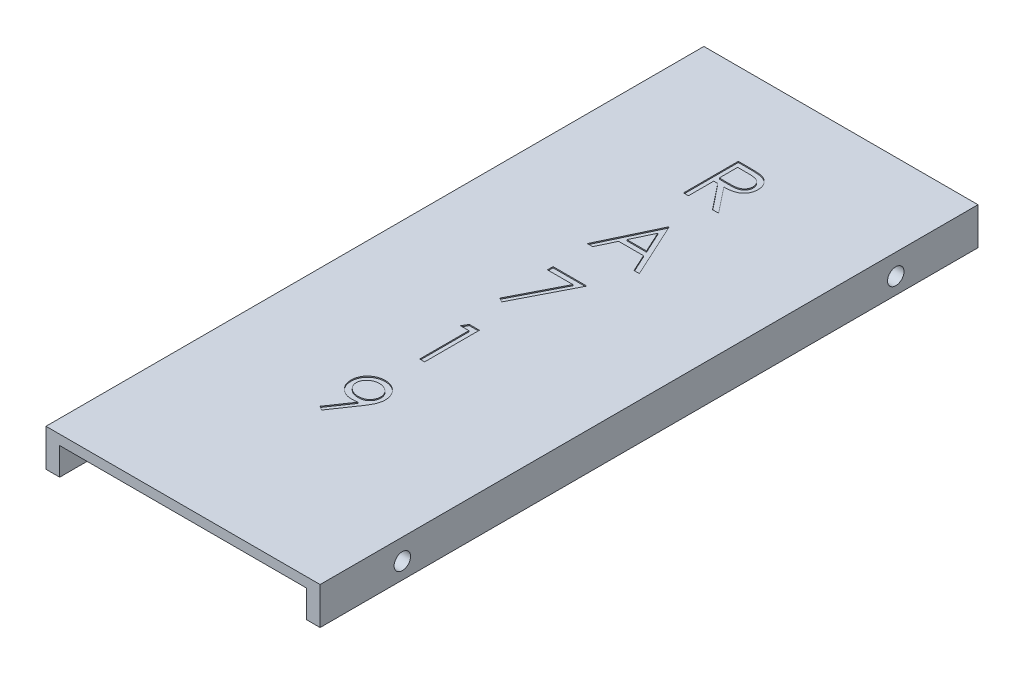
from build123d import *

# Parameters (mm, degrees)
BOSS_EXTRUDE1_DEPTH = 1200
SKETCH3_R           = 15
CUT_EXTRUDE1_DEPTH  = 1302.77724669
CUT_EXTRUDE2_DEPTH  = 2
CUT_EXTRUDE3_DEPTH  = 2


with BuildPart() as part:
    # Sketch2 → Boss-Extrude1 (new body)
    with BuildSketch(Plane.XY):
        Polygon((0, 0), (0, 68), (500, 68), (500, 0), (475, 0), (475, 50), (25, 50), (25, 0), align=None)
    extrude(amount=BOSS_EXTRUDE1_DEPTH)

    # Sketch3 → Cut-Extrude1 (cut, through all)
    with BuildSketch(Plane(origin=(500, 0, 0), x_dir=(0, 0, -1), z_dir=(1, 0, 0))):
        with Locations((-1050, 30)):
            Circle(SKETCH3_R)
        with Locations((-150, 30)):
            Circle(SKETCH3_R)
    extrude(amount=-CUT_EXTRUDE1_DEPTH, mode=Mode.SUBTRACT)

    # Sketch4 → Cut-Extrude2 (cut)
    # profile 1 of 5: a face of its own
    with BuildSketch(Plane(origin=(0, 68, 0), x_dir=(1, 0, 0), z_dir=(0, 1, 0))):
        with BuildLine():
            Line((212.820512821, -150), (232.832532051, -150))
            add(Edge.make_bspline(
                [(232.832532051, -150), (234.167992866, -150.004445314), (236.732225563, -150.012980809), (240.405747574, -150.060574035), (243.743664631, -150.196984198), (246.744231468, -150.314372298), (249.407393039, -150.528427764), (251.741315632, -150.733017682), (253.735249846, -151.000836561), (254.942274169, -151.249562931), (255.488782051, -151.362179487)],
                knots=[0, 0, 0, 0, 1.410062039, 2.707475311, 3.878576406, 4.937260626, 5.877586885, 6.699081471, 7.410979367, 8, 8, 8, 8], degree=3))
            add(Edge.make_bspline(
                [(255.488782051, -151.362179487), (256.220399884, -151.542944212), (257.668028154, -151.900617459), (259.752315756, -152.656606054), (261.738439297, -153.531452472), (263.618148563, -154.558987338), (265.382028312, -155.746838186), (267.048265763, -157.074498827), (268.624421859, -158.534704706), (270.04675415, -160.164271606), (271.387869913, -161.873886168), (272.518973527, -163.722564935), (273.494015805, -165.655751436), (274.270316291, -167.693106229), (274.895401247, -169.814871139), (275.336150944, -172.040265332), (275.60047059, -174.359150334), (275.627380749, -175.940804871), (275.641025641, -176.742788462)],
                knots=[0, 0, 0, 0, 1.027469482, 2.033020251, 3.019912614, 3.986113645, 4.951240523, 5.91722682, 6.890402269, 7.87763091, 8.8651537, 9.85103654, 10.82876324, 11.815024772, 12.821070561, 13.842952187, 14.906261191, 16, 16, 16, 16], degree=3))
            add(Edge.make_bspline(
                [(275.641025641, -176.742788462), (275.599054266, -178.075220022), (275.517157244, -180.675139104), (274.753582853, -184.448307145), (273.502825147, -187.968001849), (271.779302603, -191.229791503), (269.58446044, -194.170095657), (266.946609266, -196.752680094), (263.864277509, -198.913820453), (260.994868482, -200.412472016), (258.460177062, -201.372269406), (256.373510983, -202.047593945), (254.097311626, -202.569364381), (251.65338778, -203.036796717), (249.031569051, -203.389702272), (246.238139354, -203.6481764), (243.271106451, -203.809720648), (241.232847326, -203.833777931), (240.184294872, -203.846153846)],
                knots=[0, 0, 0, 0, 1.260483769, 2.459530307, 3.627416485, 4.787058657, 5.939039949, 7.08810263, 8.267026773, 9.491475466, 10.141966685, 10.831826277, 11.566392101, 12.351337768, 13.187381173, 14.07005841, 15.007169909, 16, 16, 16, 16], degree=3))
            Line((240.184294872, -203.846153846), (276.923076923, -250))
            Line((276.923076923, -250), (265.825320513, -250))
            Line((265.825320513, -250), (229.086538462, -203.846153846))
            Line((229.086538462, -203.846153846), (221.794871795, -203.846153846))
            Line((221.794871795, -203.846153846), (221.794871795, -250))
            Line((221.794871795, -250), (212.820512821, -250))
            Line((212.820512821, -250), (212.820512821, -150))
        make_face()
        with BuildLine():
            Line((221.794871795, -160.256410256), (221.794871795, -193.58974359))
            Line((221.794871795, -193.58974359), (240.104166667, -193.729967949))
            add(Edge.make_bspline(
                [(240.104166667, -193.729967949), (240.959024922, -193.730346139), (242.615983696, -193.731079179), (245.013145548, -193.616971286), (247.245148739, -193.487162194), (249.303455944, -193.288609464), (251.188986668, -193.0327217), (252.900798474, -192.712636436), (254.441685671, -192.339720361), (256.238786769, -191.762531052), (258.245544808, -190.848073387), (260.426443661, -189.517630567), (262.283653311, -187.844227163), (263.852735091, -185.930699847), (265.113575991, -183.826807023), (266.002491829, -181.557767903), (266.566561609, -179.180865103), (266.633091479, -177.547204879), (266.666666667, -176.72275641)],
                knots=[0, 0, 0, 0, 1.146690395, 2.22261258, 3.21895312, 4.145990853, 4.996080663, 5.770904154, 6.481378293, 7.121626537, 8.300444488, 9.431385265, 10.535395872, 11.636531494, 12.74115979, 13.810798291, 14.895190096, 16, 16, 16, 16], degree=3))
            add(Edge.make_bspline(
                [(266.666666667, -176.72275641), (266.63232035, -175.918568589), (266.564258483, -174.32496177), (266.008579382, -171.991935762), (265.068882772, -169.790022901), (263.802533117, -167.728180473), (262.259700118, -165.85658802), (260.450619755, -164.255240789), (258.424757036, -162.933827513), (256.531294226, -162.089416641), (254.838888155, -161.571706548), (253.369469297, -161.207387582), (251.709141362, -160.91468847), (249.849842545, -160.680172445), (247.799510236, -160.478602609), (245.547777348, -160.342837505), (243.109583626, -160.262441388), (241.419671307, -160.25846742), (240.544871795, -160.256410256)],
                knots=[0, 0, 0, 0, 1.101028733, 2.181837193, 3.264309656, 4.369019818, 5.486613113, 6.575447106, 7.666700264, 8.788928104, 9.402425223, 10.0903467, 10.862060571, 11.710948788, 12.657782767, 13.684531032, 14.801375019, 16, 16, 16, 16], degree=3))
            Line((240.544871795, -160.256410256), (221.794871795, -160.256410256))
        make_face(mode=Mode.SUBTRACT)
    # profile 2 of 5: a face of its own
    with BuildSketch(Plane(origin=(0, 68, 0), x_dir=(1, 0, 0), z_dir=(0, 1, 0))):
        Polygon((253.846153846, -317.666666667), (300, -417.666666667), (290.244391026, -417.666666667), (275.460737179, -385.615384615), (230.128205128, -385.615384615), (214.923878205, -417.666666667), (205.128205128, -417.666666667), (252.564102564, -317.666666667), align=None)
        Polygon((253.104967949, -337.157852564), (234.99599359, -375.358974359), (270.733173077, -375.358974359), align=None, mode=Mode.SUBTRACT)
    # profile 3 of 5: a face of its own
    with BuildSketch(Plane(origin=(0, 68, 0), x_dir=(1, 0, 0), z_dir=(0, 1, 0))):
        Polygon((210.256410256, -485.333333333), (271.794871795, -485.333333333), (219.230769231, -587.897435897), (211.478365385, -583.630608974), (256.610576923, -495.58974359), (210.256410256, -495.58974359), align=None)
    # profile 4 of 5: a face of its own
    with BuildSketch(Plane(origin=(0, 68, 0), x_dir=(1, 0, 0), z_dir=(0, 1, 0))):
        Polygon((225.100160256, -653), (243.58974359, -653), (243.58974359, -753), (234.615384615, -753), (234.615384615, -663.256410256), (219.230769231, -663.256410256), align=None)
    # profile 5 of 5: a face of its own
    with BuildSketch(Plane(origin=(0, 68, 0), x_dir=(1, 0, 0), z_dir=(0, 1, 0))):
        with BuildLine():
            Line((225.641025641, -923.230769231), (218.469551282, -918.242788462))
            Line((218.469551282, -918.242788462), (246.274038462, -877.59775641))
            add(Edge.make_bspline(
                [(246.274038462, -877.59775641), (244.500017444, -877.814701077), (241.006871155, -878.24187722), (237.488668238, -878.320353069), (235.757211538, -878.358974359)],
                knots=[0, 0, 0, 0, 1.015715272, 2, 2, 2, 2], degree=3))
            add(Edge.make_bspline(
                [(235.757211538, -878.358974359), (234.707438744, -878.33208646), (232.646826549, -878.279307866), (229.617350762, -877.860970486), (226.706334746, -877.216681121), (223.921496005, -876.255288119), (221.252367295, -875.060482147), (218.704775484, -873.578853186), (216.282150041, -871.835816284), (214.010509757, -869.840587954), (211.944460074, -867.649786455), (210.103794424, -865.3310538), (208.574047796, -862.857454638), (207.303288214, -860.279448365), (206.339560969, -857.559981198), (205.637774181, -854.729998337), (205.205706913, -851.769665709), (205.154304183, -849.754661973), (205.128205128, -848.731570513)],
                knots=[0, 0, 0, 0, 1.060718605, 2.082097864, 3.085795603, 4.069760067, 5.054557537, 6.03741023, 7.043284206, 8.066802108, 9.088538119, 10.083643548, 11.053783639, 12.022749082, 12.983451788, 13.964007469, 14.966251758, 16, 16, 16, 16], degree=3))
            add(Edge.make_bspline(
                [(205.128205128, -848.731570513), (205.177760408, -847.332466149), (205.275027369, -844.586308105), (206.057842148, -840.573914704), (207.34528041, -836.780013458), (209.140376889, -833.214579346), (211.40136893, -829.928901083), (214.118757221, -826.968655108), (217.276013343, -824.375944998), (220.80121389, -822.147257072), (224.611300197, -820.354828578), (228.601833285, -819.033705707), (232.742236716, -818.256598626), (235.547027291, -818.154145451), (236.959134615, -818.102564103)],
                knots=[0, 0, 0, 0, 1.022988612, 2.007919123, 2.978103895, 3.94594894, 4.918897164, 5.887013414, 6.875921846, 7.89917871, 8.930658928, 9.948724884, 10.967259574, 12, 12, 12, 12], degree=3))
            add(Edge.make_bspline(
                [(236.959134615, -818.102564103), (238.344518032, -818.154854476), (241.081905084, -818.258175324), (245.107305272, -819.014860155), (248.962762899, -820.290193664), (252.626905376, -822.052609771), (256.019460011, -824.261778562), (259.070197474, -826.894193526), (261.709498591, -829.951494304), (263.933038041, -833.359736877), (265.717896335, -837.021650625), (267.005675849, -840.844048411), (267.798408391, -844.799440448), (267.898303451, -847.479282564), (267.948717949, -848.831730769)],
                knots=[0, 0, 0, 0, 1.026385292, 2.028040595, 3.023318987, 4.028184125, 5.03290303, 6.015178782, 7.004435299, 8.016004309, 9.023023918, 10.015172535, 10.998308025, 12, 12, 12, 12], degree=3))
            add(Edge.make_bspline(
                [(267.948717949, -848.831730769), (267.915049123, -849.881552688), (267.84676033, -852.01085385), (267.368580127, -855.246006502), (266.556574835, -858.544613059), (265.635097729, -861.336658651), (264.745607224, -863.642614359), (263.908432033, -865.464088073), (262.979513361, -867.381267025), (261.896120061, -869.374048108), (260.731483012, -871.467834821), (259.415503682, -873.6416267), (257.978201631, -875.898340791), (256.954495353, -877.419686163), (256.430288462, -878.198717949)],
                knots=[0, 0, 0, 0, 1.179839688, 2.393009684, 3.667231171, 4.993948276, 5.694988576, 6.444077775, 7.246288328, 8.089075292, 8.993003841, 9.939041771, 10.944649915, 12, 12, 12, 12], degree=3))
            Line((256.430288462, -878.198717949), (225.641025641, -923.230769231))
        make_face()
        with BuildLine():
            add(Edge.make_bspline(
                [(237.419871795, -868.102564103), (238.215129341, -868.080838852), (239.763225429, -868.038547175), (242.031148258, -867.781140264), (244.171839784, -867.324740661), (246.191018336, -866.669891745), (248.108929819, -865.879701205), (249.895110625, -864.87364446), (251.551055631, -863.673169176), (253.087853547, -862.324311586), (254.452539254, -860.825723484), (255.668054417, -859.257234722), (256.701213486, -857.611960152), (257.517307117, -855.869295515), (258.188294987, -854.071660988), (258.65166676, -852.190107981), (258.908361996, -850.234439391), (258.952121279, -848.905906305), (258.974358974, -848.230769231)],
                knots=[0, 0, 0, 0, 1.163407946, 2.26475976, 3.333800367, 4.359385343, 5.366239384, 6.363380779, 7.350133999, 8.353570782, 9.349036268, 10.310270964, 11.253520213, 12.184142, 13.120487599, 14.056272588, 15.012232024, 16, 16, 16, 16], degree=3))
            add(Edge.make_bspline(
                [(258.974358974, -848.230769231), (258.955225569, -847.555350224), (258.917520848, -846.224354225), (258.61502657, -844.265790228), (258.082877338, -842.388839919), (257.36886349, -840.583227635), (256.428285266, -838.863788439), (255.299614245, -837.208934959), (253.958687108, -835.62915988), (252.415756646, -834.161617492), (250.751912275, -832.808820371), (248.978755125, -831.614932486), (247.110900382, -830.614326875), (245.159743529, -829.788642022), (243.121219274, -829.144305574), (240.996533896, -828.680952298), (238.774950882, -828.424616453), (237.266914134, -828.381133753), (236.498397436, -828.358974359)],
                knots=[0, 0, 0, 0, 0.972161553, 1.915763587, 2.844109794, 3.775983486, 4.705125789, 5.659731448, 6.655561913, 7.682237399, 8.721216875, 9.739758359, 10.754845918, 11.767244016, 12.7857855, 13.828538656, 14.893392813, 16, 16, 16, 16], degree=3))
            add(Edge.make_bspline(
                [(236.498397436, -828.358974359), (235.736564483, -828.38116955), (234.241854503, -828.424716332), (232.040021376, -828.680465051), (229.929702295, -829.147421743), (227.897084573, -829.788343565), (225.945985696, -830.614388469), (224.078219049, -831.614984916), (222.304647143, -832.808545551), (220.642397977, -834.162681907), (219.096743061, -835.622328939), (217.778870804, -837.21585548), (216.647616745, -838.862927607), (215.70833095, -840.583456414), (214.993973313, -842.388778859), (214.461916124, -844.265806767), (214.159397117, -846.224349915), (214.121695787, -847.555348774), (214.102564103, -848.230769231)],
                knots=[0, 0, 0, 0, 1.099389452, 2.15699305, 3.192601482, 4.213358962, 5.227959689, 6.245255729, 7.266013209, 8.307253147, 9.336162325, 10.327954924, 11.284637477, 12.215801273, 13.149702402, 14.080068371, 15.025723358, 16, 16, 16, 16], degree=3))
            add(Edge.make_bspline(
                [(214.102564103, -848.230769231), (214.119876277, -848.906432052), (214.154019054, -850.2389628), (214.483384475, -852.196859739), (215.03419247, -854.073665282), (215.771889344, -855.887628339), (216.743363348, -857.62111), (217.93547329, -859.265891769), (219.332774605, -860.840618917), (220.916588539, -862.32082497), (222.649964566, -863.679458557), (224.501300169, -864.8660409), (226.43872408, -865.868110741), (228.469056388, -866.672150281), (230.57725067, -867.318197809), (232.782254424, -867.780299104), (235.076775495, -868.036078154), (236.631346404, -868.080189496), (237.419871795, -868.102564103)],
                knots=[0, 0, 0, 0, 0.952633368, 1.87876736, 2.791047057, 3.707742249, 4.635551637, 5.587206343, 6.568248508, 7.601284464, 8.641511608, 9.671105535, 10.699146789, 11.713763218, 12.747829548, 13.806491675, 14.887386225, 16, 16, 16, 16], degree=3))
        make_face(mode=Mode.SUBTRACT)
    extrude(amount=-CUT_EXTRUDE2_DEPTH, mode=Mode.SUBTRACT)

    # Sketch5 → Cut-Extrude3 (cut)
    # profile 1 of 5: a face of its own
    with BuildSketch(Plane.XZ.offset(-50)):
        with BuildLine():
            Line((212.820512821, 1050), (232.832532051, 1050))
            add(Edge.make_bspline(
                [(232.832532051, 1050), (234.167992866, 1049.995554686), (236.732225563, 1049.987019191), (240.405747574, 1049.939425965), (243.743664631, 1049.803015802), (246.744231468, 1049.685627702), (249.407393039, 1049.471572236), (251.741315632, 1049.266982318), (253.735249846, 1048.999163439), (254.942274169, 1048.750437069), (255.488782051, 1048.637820513)],
                knots=[0, 0, 0, 0, 1.410062039, 2.707475311, 3.878576406, 4.937260626, 5.877586885, 6.699081471, 7.410979367, 8, 8, 8, 8], degree=3))
            add(Edge.make_bspline(
                [(255.488782051, 1048.637820513), (256.220399884, 1048.457055788), (257.668028154, 1048.099382541), (259.752315756, 1047.343393946), (261.738439297, 1046.468547528), (263.618148563, 1045.441012662), (265.382028312, 1044.253161814), (267.048265763, 1042.925501173), (268.624421859, 1041.465295294), (270.04675415, 1039.835728394), (271.387869913, 1038.126113832), (272.518973527, 1036.277435065), (273.494015805, 1034.344248564), (274.270316291, 1032.306893771), (274.895401247, 1030.185128861), (275.336150944, 1027.959734668), (275.60047059, 1025.640849666), (275.627380749, 1024.059195129), (275.641025641, 1023.257211538)],
                knots=[0, 0, 0, 0, 1.027469482, 2.033020251, 3.019912614, 3.986113645, 4.951240523, 5.91722682, 6.890402269, 7.87763091, 8.8651537, 9.85103654, 10.82876324, 11.815024772, 12.821070561, 13.842952187, 14.906261191, 16, 16, 16, 16], degree=3))
            add(Edge.make_bspline(
                [(275.641025641, 1023.257211538), (275.599054266, 1021.924779978), (275.517157244, 1019.324860896), (274.753582853, 1015.551692855), (273.502825147, 1012.031998151), (271.779302603, 1008.770208497), (269.58446044, 1005.829904343), (266.946609266, 1003.247319906), (263.864277509, 1001.086179547), (260.994868482, 999.587527984), (258.460177062, 998.627730594), (256.373510983, 997.952406055), (254.097311626, 997.430635619), (251.65338778, 996.963203283), (249.031569051, 996.610297728), (246.238139354, 996.3518236), (243.271106451, 996.190279352), (241.232847326, 996.166222069), (240.184294872, 996.153846154)],
                knots=[0, 0, 0, 0, 1.260483769, 2.459530307, 3.627416485, 4.787058657, 5.939039949, 7.08810263, 8.267026773, 9.491475466, 10.141966685, 10.831826277, 11.566392101, 12.351337768, 13.187381173, 14.07005841, 15.007169909, 16, 16, 16, 16], degree=3))
            Line((240.184294872, 996.153846154), (276.923076923, 950))
            Line((276.923076923, 950), (265.825320513, 950))
            Line((265.825320513, 950), (229.086538462, 996.153846154))
            Line((229.086538462, 996.153846154), (221.794871795, 996.153846154))
            Line((221.794871795, 996.153846154), (221.794871795, 950))
            Line((221.794871795, 950), (212.820512821, 950))
            Line((212.820512821, 950), (212.820512821, 1050))
        make_face()
        with BuildLine():
            Line((221.794871795, 1039.743589744), (221.794871795, 1006.41025641))
            Line((221.794871795, 1006.41025641), (240.104166667, 1006.270032051))
            add(Edge.make_bspline(
                [(240.104166667, 1006.270032051), (240.959024922, 1006.269653861), (242.615983696, 1006.268920821), (245.013145548, 1006.383028714), (247.245148739, 1006.512837806), (249.303455944, 1006.711390536), (251.188986668, 1006.9672783), (252.900798474, 1007.287363564), (254.441685671, 1007.660279639), (256.238786769, 1008.237468948), (258.245544808, 1009.151926613), (260.426443661, 1010.482369433), (262.283653311, 1012.155772837), (263.852735091, 1014.069300153), (265.113575991, 1016.173192977), (266.002491829, 1018.442232097), (266.566561609, 1020.819134897), (266.633091479, 1022.452795121), (266.666666667, 1023.27724359)],
                knots=[0, 0, 0, 0, 1.146690395, 2.22261258, 3.21895312, 4.145990853, 4.996080663, 5.770904154, 6.481378293, 7.121626537, 8.300444488, 9.431385265, 10.535395872, 11.636531494, 12.74115979, 13.810798291, 14.895190096, 16, 16, 16, 16], degree=3))
            add(Edge.make_bspline(
                [(266.666666667, 1023.27724359), (266.63232035, 1024.081431411), (266.564258483, 1025.67503823), (266.008579382, 1028.008064238), (265.068882772, 1030.209977099), (263.802533117, 1032.271819527), (262.259700118, 1034.14341198), (260.450619755, 1035.744759211), (258.424757036, 1037.066172487), (256.531294226, 1037.910583359), (254.838888155, 1038.428293452), (253.369469297, 1038.792612418), (251.709141362, 1039.08531153), (249.849842545, 1039.319827555), (247.799510236, 1039.521397391), (245.547777348, 1039.657162495), (243.109583626, 1039.737558612), (241.419671307, 1039.74153258), (240.544871795, 1039.743589744)],
                knots=[0, 0, 0, 0, 1.101028733, 2.181837193, 3.264309656, 4.369019818, 5.486613113, 6.575447106, 7.666700264, 8.788928104, 9.402425223, 10.0903467, 10.862060571, 11.710948788, 12.657782767, 13.684531032, 14.801375019, 16, 16, 16, 16], degree=3))
            Line((240.544871795, 1039.743589744), (221.794871795, 1039.743589744))
        make_face(mode=Mode.SUBTRACT)
    # profile 2 of 5: a face of its own
    with BuildSketch(Plane.XZ.offset(-50)):
        Polygon((253.846153846, 882.333333333), (300, 782.333333333), (290.244391026, 782.333333333), (275.460737179, 814.384615385), (230.128205128, 814.384615385), (214.923878205, 782.333333333), (205.128205128, 782.333333333), (252.564102564, 882.333333333), align=None)
        Polygon((253.104967949, 862.842147436), (234.99599359, 824.641025641), (270.733173077, 824.641025641), align=None, mode=Mode.SUBTRACT)
    # profile 3 of 5: a face of its own
    with BuildSketch(Plane.XZ.offset(-50)):
        Polygon((210.256410256, 714.666666667), (271.794871795, 714.666666667), (219.230769231, 612.102564103), (211.478365385, 616.369391026), (256.610576923, 704.41025641), (210.256410256, 704.41025641), align=None)
    # profile 4 of 5: a face of its own
    with BuildSketch(Plane.XZ.offset(-50)):
        Polygon((225.100160256, 547), (243.58974359, 547), (243.58974359, 447), (234.615384615, 447), (234.615384615, 536.743589744), (219.230769231, 536.743589744), align=None)
    # profile 5 of 5: a face of its own
    with BuildSketch(Plane.XZ.offset(-50)):
        with BuildLine():
            Line((225.641025641, 276.769230769), (218.469551282, 281.757211538))
            Line((218.469551282, 281.757211538), (246.274038462, 322.40224359))
            add(Edge.make_bspline(
                [(246.274038462, 322.40224359), (244.500017444, 322.185298923), (241.006871155, 321.75812278), (237.488668238, 321.679646931), (235.757211538, 321.641025641)],
                knots=[0, 0, 0, 0, 1.015715272, 2, 2, 2, 2], degree=3))
            add(Edge.make_bspline(
                [(235.757211538, 321.641025641), (234.707438744, 321.66791354), (232.646826549, 321.720692134), (229.617350762, 322.139029514), (226.706334746, 322.783318879), (223.921496005, 323.744711881), (221.252367295, 324.939517853), (218.704775484, 326.421146814), (216.282150041, 328.164183716), (214.010509757, 330.159412046), (211.944460074, 332.350213545), (210.103794424, 334.6689462), (208.574047796, 337.142545362), (207.303288214, 339.720551635), (206.339560969, 342.440018802), (205.637774181, 345.270001663), (205.205706913, 348.230334291), (205.154304183, 350.245338027), (205.128205128, 351.268429487)],
                knots=[0, 0, 0, 0, 1.060718605, 2.082097864, 3.085795603, 4.069760067, 5.054557537, 6.03741023, 7.043284206, 8.066802108, 9.088538119, 10.083643548, 11.053783639, 12.022749082, 12.983451788, 13.964007469, 14.966251758, 16, 16, 16, 16], degree=3))
            add(Edge.make_bspline(
                [(205.128205128, 351.268429487), (205.177760408, 352.667533851), (205.275027369, 355.413691895), (206.057842148, 359.426085296), (207.34528041, 363.219986542), (209.140376889, 366.785420654), (211.40136893, 370.071098917), (214.118757221, 373.031344892), (217.276013343, 375.624055002), (220.80121389, 377.852742928), (224.611300197, 379.645171422), (228.601833285, 380.966294293), (232.742236716, 381.743401374), (235.547027291, 381.845854549), (236.959134615, 381.897435897)],
                knots=[0, 0, 0, 0, 1.022988612, 2.007919123, 2.978103895, 3.94594894, 4.918897164, 5.887013414, 6.875921846, 7.89917871, 8.930658928, 9.948724884, 10.967259574, 12, 12, 12, 12], degree=3))
            add(Edge.make_bspline(
                [(236.959134615, 381.897435897), (238.344518032, 381.845145524), (241.081905084, 381.741824676), (245.107305272, 380.985139845), (248.962762899, 379.709806336), (252.626905376, 377.947390229), (256.019460011, 375.738221438), (259.070197474, 373.105806474), (261.709498591, 370.048505696), (263.933038041, 366.640263123), (265.717896335, 362.978349375), (267.005675849, 359.155951589), (267.798408391, 355.200559552), (267.898303451, 352.520717436), (267.948717949, 351.168269231)],
                knots=[0, 0, 0, 0, 1.026385292, 2.028040595, 3.023318987, 4.028184125, 5.03290303, 6.015178782, 7.004435299, 8.016004309, 9.023023918, 10.015172535, 10.998308025, 12, 12, 12, 12], degree=3))
            add(Edge.make_bspline(
                [(267.948717949, 351.168269231), (267.915049123, 350.118447312), (267.84676033, 347.98914615), (267.368580127, 344.753993498), (266.556574835, 341.455386941), (265.635097729, 338.663341349), (264.745607224, 336.357385641), (263.908432033, 334.535911927), (262.979513361, 332.618732975), (261.896120061, 330.625951892), (260.731483012, 328.532165179), (259.415503682, 326.3583733), (257.978201631, 324.101659209), (256.954495353, 322.580313837), (256.430288462, 321.801282051)],
                knots=[0, 0, 0, 0, 1.179839688, 2.393009684, 3.667231171, 4.993948276, 5.694988576, 6.444077775, 7.246288328, 8.089075292, 8.993003841, 9.939041771, 10.944649915, 12, 12, 12, 12], degree=3))
            Line((256.430288462, 321.801282051), (225.641025641, 276.769230769))
        make_face()
        with BuildLine():
            add(Edge.make_bspline(
                [(237.419871795, 331.897435897), (238.215129341, 331.919161148), (239.763225429, 331.961452825), (242.031148258, 332.218859736), (244.171839784, 332.675259339), (246.191018336, 333.330108255), (248.108929819, 334.120298795), (249.895110625, 335.12635554), (251.551055631, 336.326830824), (253.087853547, 337.675688414), (254.452539254, 339.174276516), (255.668054417, 340.742765278), (256.701213486, 342.388039848), (257.517307117, 344.130704485), (258.188294987, 345.928339012), (258.65166676, 347.809892019), (258.908361996, 349.765560609), (258.952121279, 351.094093695), (258.974358974, 351.769230769)],
                knots=[0, 0, 0, 0, 1.163407946, 2.26475976, 3.333800367, 4.359385343, 5.366239384, 6.363380779, 7.350133999, 8.353570782, 9.349036268, 10.310270964, 11.253520213, 12.184142, 13.120487599, 14.056272588, 15.012232024, 16, 16, 16, 16], degree=3))
            add(Edge.make_bspline(
                [(258.974358974, 351.769230769), (258.955225569, 352.444649776), (258.917520848, 353.775645775), (258.61502657, 355.734209772), (258.082877338, 357.611160081), (257.36886349, 359.416772365), (256.428285266, 361.136211561), (255.299614245, 362.791065041), (253.958687108, 364.37084012), (252.415756646, 365.838382508), (250.751912275, 367.191179629), (248.978755125, 368.385067514), (247.110900382, 369.385673125), (245.159743529, 370.211357978), (243.121219274, 370.855694426), (240.996533896, 371.319047702), (238.774950882, 371.575383547), (237.266914134, 371.618866247), (236.498397436, 371.641025641)],
                knots=[0, 0, 0, 0, 0.972161553, 1.915763587, 2.844109794, 3.775983486, 4.705125789, 5.659731448, 6.655561913, 7.682237399, 8.721216875, 9.739758359, 10.754845918, 11.767244016, 12.7857855, 13.828538656, 14.893392813, 16, 16, 16, 16], degree=3))
            add(Edge.make_bspline(
                [(236.498397436, 371.641025641), (235.736564483, 371.61883045), (234.241854503, 371.575283668), (232.040021376, 371.319534949), (229.929702295, 370.852578257), (227.897084573, 370.211656435), (225.945985696, 369.385611531), (224.078219049, 368.385015084), (222.304647143, 367.191454449), (220.642397977, 365.837318093), (219.096743061, 364.377671061), (217.778870804, 362.78414452), (216.647616745, 361.137072393), (215.70833095, 359.416543586), (214.993973313, 357.611221141), (214.461916124, 355.734193233), (214.159397117, 353.775650085), (214.121695787, 352.444651226), (214.102564103, 351.769230769)],
                knots=[0, 0, 0, 0, 1.099389452, 2.15699305, 3.192601482, 4.213358962, 5.227959689, 6.245255729, 7.266013209, 8.307253147, 9.336162325, 10.327954924, 11.284637477, 12.215801273, 13.149702402, 14.080068371, 15.025723358, 16, 16, 16, 16], degree=3))
            add(Edge.make_bspline(
                [(214.102564103, 351.769230769), (214.119876277, 351.093567948), (214.154019054, 349.7610372), (214.483384475, 347.803140261), (215.03419247, 345.926334718), (215.771889344, 344.112371661), (216.743363348, 342.37889), (217.93547329, 340.734108231), (219.332774605, 339.159381083), (220.916588539, 337.67917503), (222.649964566, 336.320541443), (224.501300169, 335.1339591), (226.43872408, 334.131889259), (228.469056388, 333.327849719), (230.57725067, 332.681802191), (232.782254424, 332.219700896), (235.076775495, 331.963921846), (236.631346404, 331.919810504), (237.419871795, 331.897435897)],
                knots=[0, 0, 0, 0, 0.952633368, 1.87876736, 2.791047057, 3.707742249, 4.635551637, 5.587206343, 6.568248508, 7.601284464, 8.641511608, 9.671105535, 10.699146789, 11.713763218, 12.747829548, 13.806491675, 14.887386225, 16, 16, 16, 16], degree=3))
        make_face(mode=Mode.SUBTRACT)
    extrude(amount=-CUT_EXTRUDE3_DEPTH, mode=Mode.SUBTRACT)


solid = part.part
